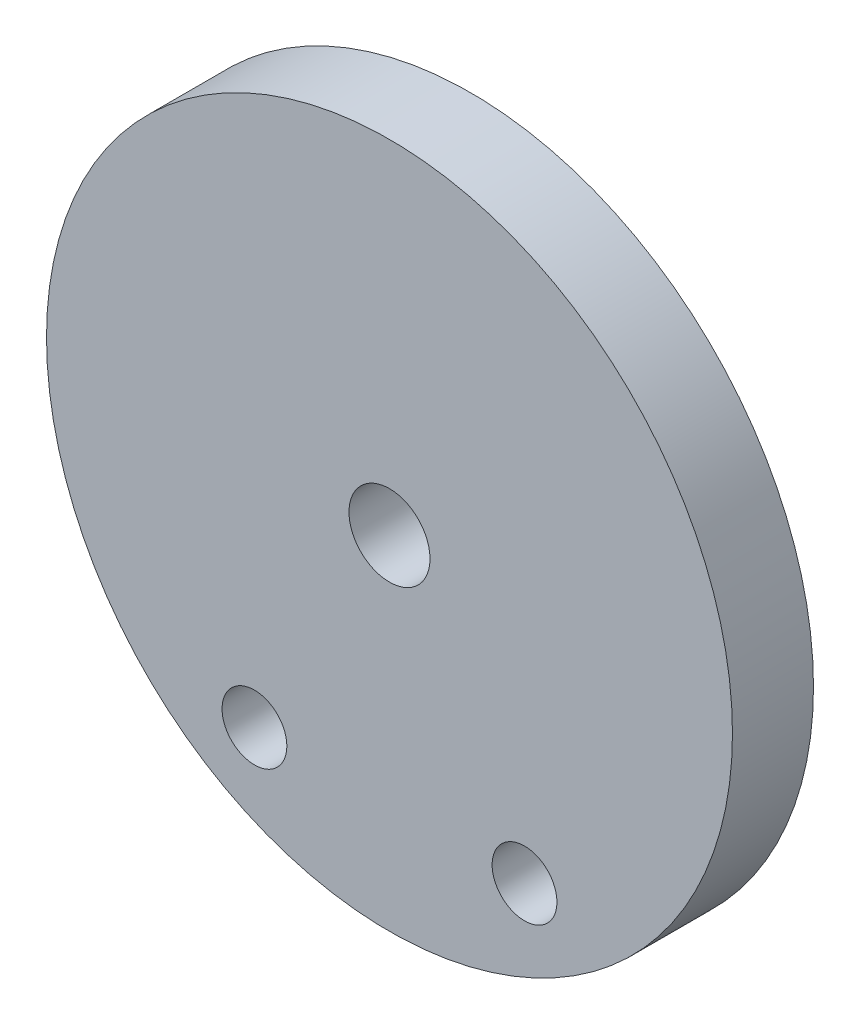
from build123d import *

# Parameters (mm, degrees)
SKETCH1_R           = 12.7
SKETCH1_R_2         = 1.5
SKETCH1_R_3         = 1.2
BOSS_EXTRUDE1_DEPTH = 3


with BuildPart() as part:
    # Sketch1 → Boss-Extrude1 (new body)
    with BuildSketch(Plane.XY):
        Circle(SKETCH1_R)
        Circle(SKETCH1_R_2, mode=Mode.SUBTRACT)
        with Locations((5, -8.66)):
            Circle(SKETCH1_R_3, mode=Mode.SUBTRACT)
        with Locations((-5, -8.66)):
            Circle(SKETCH1_R_3, mode=Mode.SUBTRACT)
    extrude(amount=BOSS_EXTRUDE1_DEPTH)


solid = part.part
